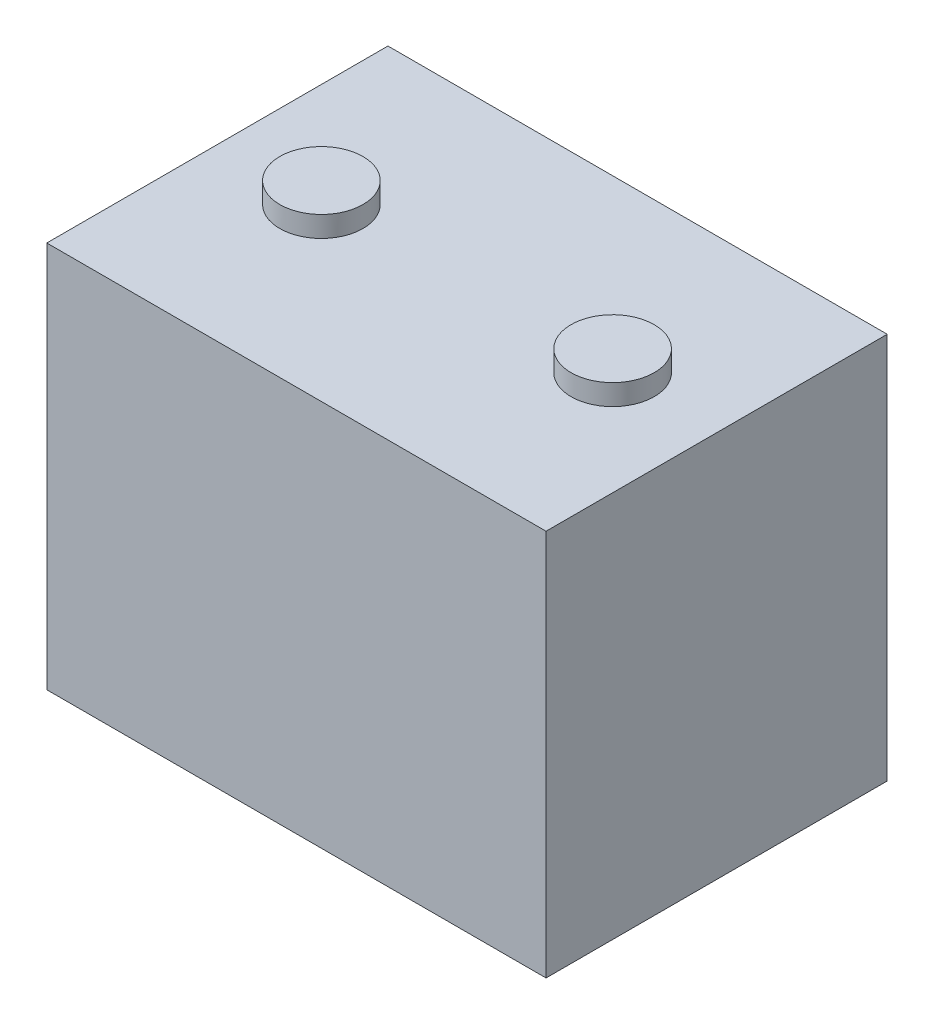
from build123d import *

# Parameters (mm, degrees)
ESQUISSE1_W        = 120
ESQUISSE1_H        = 93
BOSS_EXTRU_1_DEPTH = 82
ESQUISSE2_R        = 10
BOSS_EXTRU_2_DEPTH = 5


with BuildPart() as part:
    # Esquisse1 → Boss.-Extru.1 (new body)
    with BuildSketch(Plane.XY):
        with Locations((-27.583333333, 20.25)):
            Rectangle(ESQUISSE1_W, ESQUISSE1_H)
    extrude(amount=BOSS_EXTRU_1_DEPTH)

    # Esquisse2 → Boss.-Extru.2 (add)
    with BuildSketch(Plane(origin=(0, 66.75, 0), x_dir=(1, 0, 0), z_dir=(0, 1, 0))):
        with Locations(Location((-62.583333333, -41, 0), (0, 0, 90))):
            Circle(ESQUISSE2_R)
        with Locations(Location((7.416666667, -41, 0), (0, 0, 90))):
            Circle(ESQUISSE2_R)
    extrude(amount=BOSS_EXTRU_2_DEPTH)


solid = part.part
